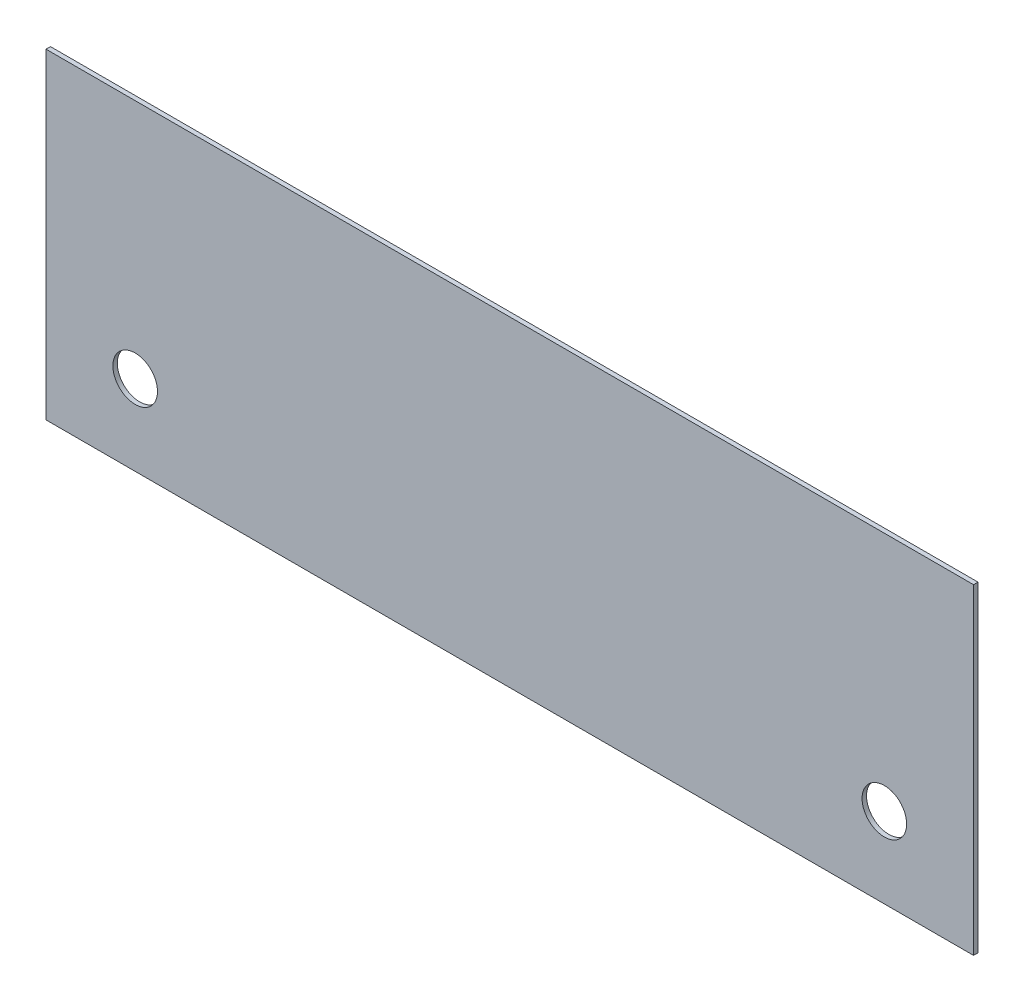
from build123d import *

# Parameters (mm, degrees)
SKETCH_1_W            = 104
SKETCH_1_H            = 36
EXTRUDE_325_DEPTH     = 0.5
SKETCH_2_R            = 2.5
CUT_EXTRUDE_438_DEPTH = 0.5


with BuildPart() as part:
    # 草图1 → Extrude 325 (new body)
    with BuildSketch(Plane.XY):
        with Locations((0, -21)):
            Rectangle(SKETCH_1_W, SKETCH_1_H)
    extrude(amount=EXTRUDE_325_DEPTH)

    # 草图2 → Cut-Extrude 438 (cut)
    with BuildSketch(Plane.XY):
        with Locations((-42, -30)):
            Circle(SKETCH_2_R)
        with Locations((42, -30)):
            Circle(SKETCH_2_R)
    extrude(amount=CUT_EXTRUDE_438_DEPTH, mode=Mode.SUBTRACT)


solid = part.part
